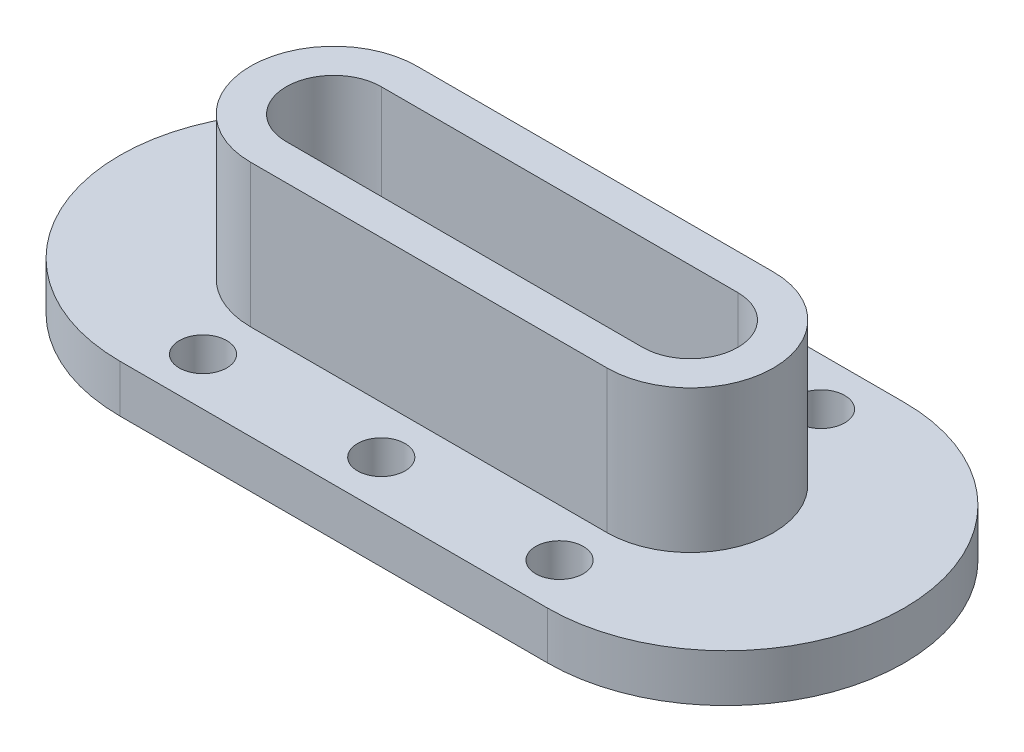
from build123d import *

# Parameters (mm, degrees)
BOSS_EXTRUDE1_DEPTH = 10
BOSS_EXTRUDE2_DEPTH = 60
HOLE1_D             = 20
HOLE2_D             = 15


with BuildPart() as part:
    # Sketch1 → Boss-Extrude1 (new, symmetric)
    with BuildSketch(Plane(origin=(0, 0, 0), x_dir=(1, 0, 0), z_dir=(0, 1, 0))):
        with BuildLine():
            Line((-90, 75), (90, 75))
            ThreePointArc((90, 75), (165, 0), (90, -75))
            Line((90, -75), (-90, -75))
            ThreePointArc((-90, -75), (-165, 0), (-90, 75))
        make_face()
    extrude(amount=BOSS_EXTRUDE1_DEPTH, both=True)

    # Sketch2 → Boss-Extrude2 (add)
    with BuildSketch(Plane(origin=(0, 10, 0), x_dir=(1, 0, 0), z_dir=(0, 1, 0))):
        with BuildLine():
            Line((-75, 35), (75, 35))
            ThreePointArc((75, 35), (110, 0), (75, -35))
            Line((75, -35), (-75, -35))
            ThreePointArc((-75, -35), (-110, 0), (-75, 35))
        make_face()
        with BuildLine():
            Line((-75, 20), (75, 20))
            ThreePointArc((75, 20), (95, 0), (75, -20))
            Line((75, -20), (-75, -20))
            ThreePointArc((-75, -20), (-95, 0), (-75, 20))
        make_face(mode=Mode.SUBTRACT)
    extrude(amount=BOSS_EXTRUDE2_DEPTH)

    # Hole1 (through all)
    with Locations(Plane(origin=(0, 10, 0), x_dir=(1, 0, 0), z_dir=(0, 1, 0))):
        with Locations((75, -55), (0, -55), (-75, -55)):
            hole1 = Hole(HOLE1_D / 2)

    # Mirror1: Hole1 across plane
    add(hole1.mirror(Plane.XY), mode=Mode.SUBTRACT)

    # Hole2 (through all)
    with Locations(Plane(origin=(0, 10, 0), x_dir=(1, 0, 0), z_dir=(0, 1, 0))):
        with Locations((0, 0), (75, 0), (-75, 0)):
            Hole(HOLE2_D / 2)


solid = part.part
